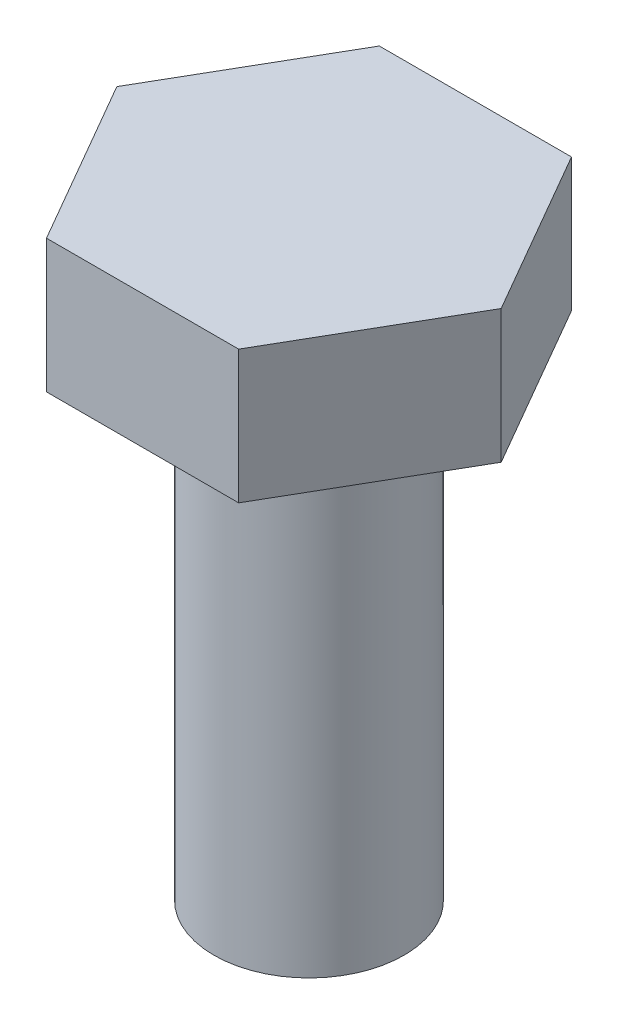
from build123d import *

# Parameters (mm, degrees)
SKETCH_1_R      = 2
EXTRUDE_1_DEPTH = 10
EXTRUDE_2_DEPTH = 2.8


with BuildPart() as part:
    # 草图1 → 凸台-拉伸1 (new body)
    with BuildSketch(Plane(origin=(0, 0, 0), x_dir=(1, 0, 0), z_dir=(0, 1, 0))):
        with Locations(Location((0, 0, 0), (0, 0, 270))):
            Circle(SKETCH_1_R)
    extrude(amount=EXTRUDE_1_DEPTH)

    # 草图2 → 凸台-拉伸2 (add)
    with BuildSketch(Plane(origin=(0, 10, 0), x_dir=(1, 0, 0), z_dir=(0, 1, 0))):
        Polygon((4.041451884, 0), (2.020725942, 3.5), (-2.020725942, 3.5), (-4.041451884, 0), (-2.020725942, -3.5), (2.020725942, -3.5), align=None)
    extrude(amount=EXTRUDE_2_DEPTH)


solid = part.part
